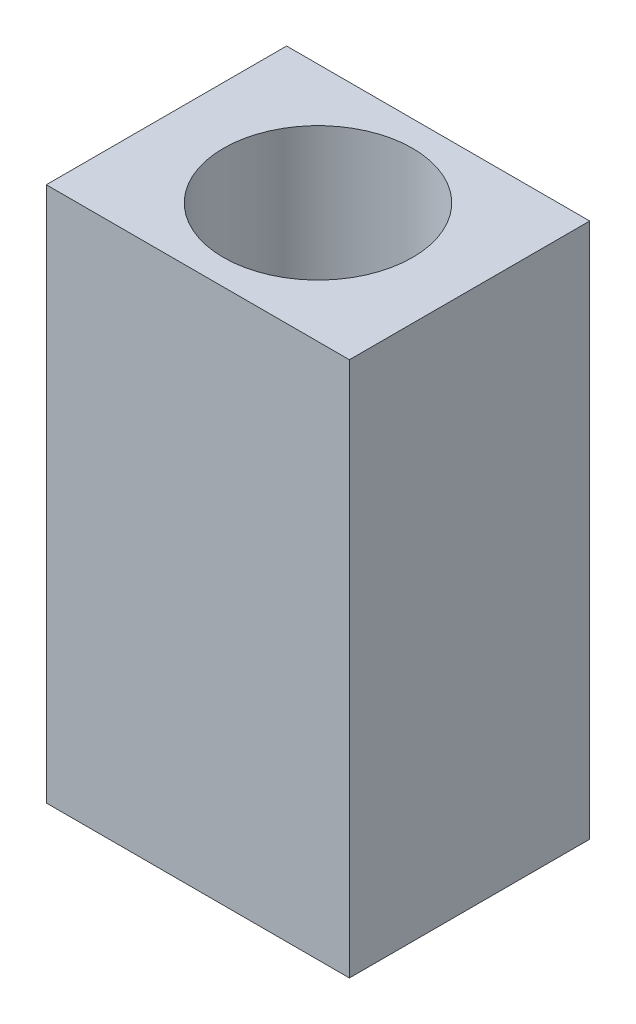
from build123d import *

# Parameters (mm, degrees)
SKETCH1_W                    = 8.491382686
SKETCH1_H                    = 6.732196236
SKETCH1_R                    = 2.5
BOSS_EXTRUDE1_DEPTH          = 15
TALADRO_DE_MARGEN_PARA_M51_D = 5.3


with BuildPart() as part:
    # Sketch1 → Boss-Extrude1 (new body)
    with BuildSketch(Plane(origin=(0, 0, 0), x_dir=(1, 0, 0), z_dir=(0, 1, 0))):
        Rectangle(SKETCH1_W, SKETCH1_H)
        with Locations(Location((0, 0, 0), (0, 0, 270))):
            Circle(SKETCH1_R, mode=Mode.SUBTRACT)
    extrude(amount=BOSS_EXTRUDE1_DEPTH)

    # Taladro de margen para M51 (through all)
    with Locations(Plane(origin=(0, 15, 0), x_dir=(1, 0, 0), z_dir=(0, 1, 0))):
        with Locations((0, 0)):
            Hole(TALADRO_DE_MARGEN_PARA_M51_D / 2)


solid = part.part
